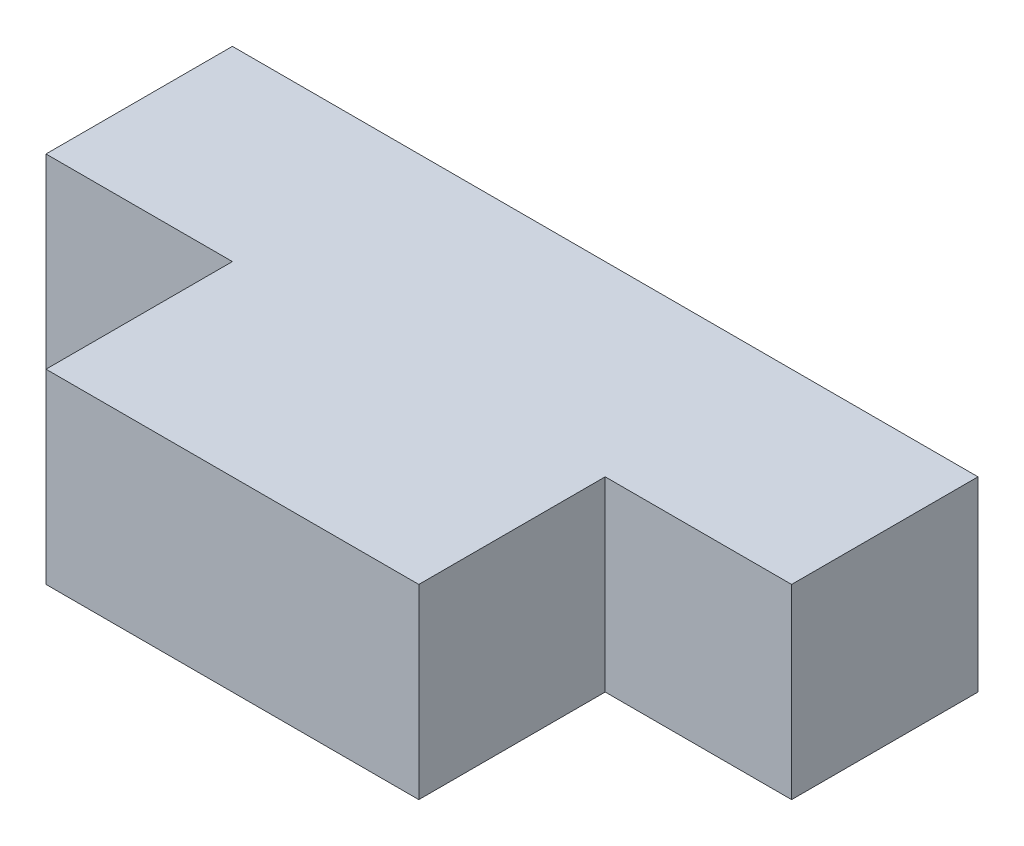
from build123d import *

# Parameters (mm, degrees)
BOSS_EXTRUDE1_DEPTH = 5


with BuildPart() as part:
    # Sketch1 → Boss-Extrude1 (new body)
    with BuildSketch(Plane(origin=(0, 0, 0), x_dir=(1, 0, 0), z_dir=(0, 1, 0))):
        Polygon((0, 0), (0, -5), (5, -5), (5, -10), (15, -10), (15, -5), (20, -5), (20, 0), align=None)
    extrude(amount=BOSS_EXTRUDE1_DEPTH)


solid = part.part
